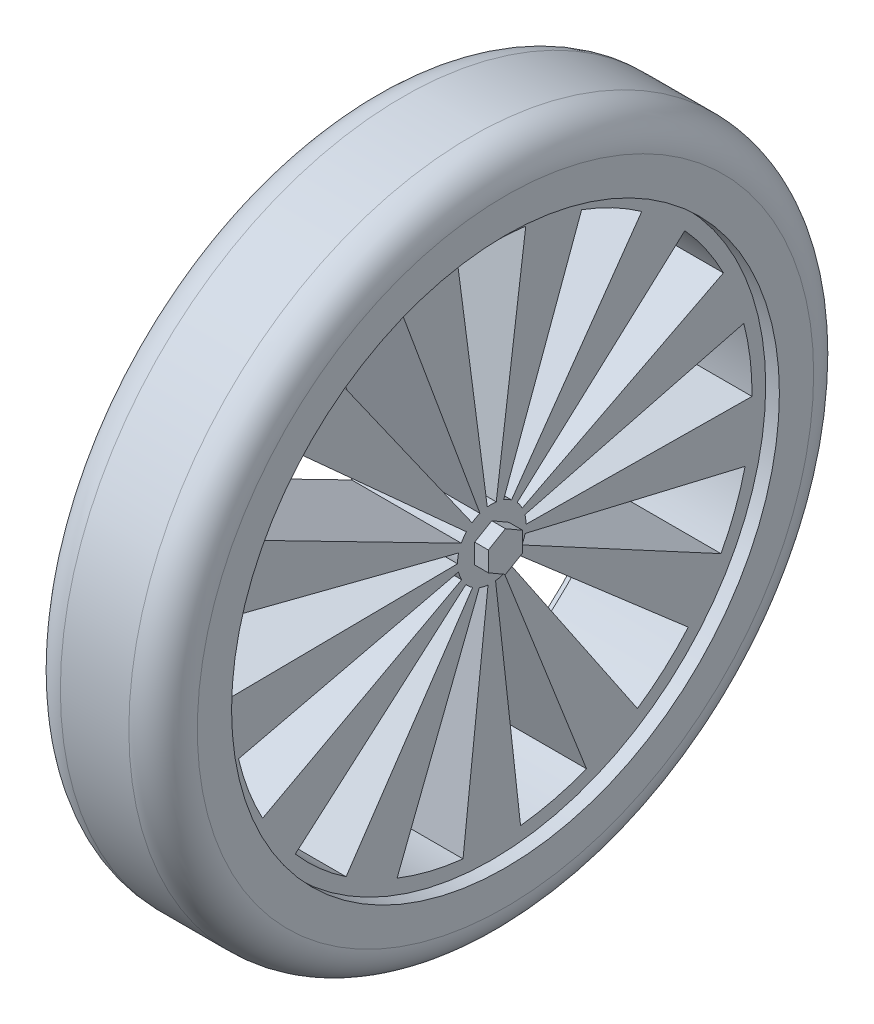
from build123d import *

# Parameters (mm, degrees)
SKETCH1_R           = 50
BOSS_EXTRUDE1_DEPTH = 20
SKETCH2_R           = 40
CUT_EXTRUDE1_DEPTH  = 2
CUT_EXTRUDE2_DEPTH  = 73.965745388
CIRPATTERN1_COUNT   = 13
FILLET1_R           = 5
BOSS_EXTRUDE2_DEPTH = 2


with BuildPart() as part:
    # Sketch1 → Boss-Extrude1 (new body)
    with BuildSketch(Plane(origin=(0, 0, 0), x_dir=(0, 0, -1), z_dir=(1, 0, 0))):
        Circle(SKETCH1_R)
    extrude(amount=BOSS_EXTRUDE1_DEPTH)

    # Sketch2 → Cut-Extrude1 (cut)
    with BuildSketch(Plane.ZY):
        Circle(SKETCH2_R)
    cut_extrude1 = extrude(amount=-CUT_EXTRUDE1_DEPTH, mode=Mode.SUBTRACT)

    # Mirror1: Cut-Extrude1 across plane
    add(cut_extrude1.mirror(Plane(origin=(10, 0, 0), x_dir=(0, 0, 1), z_dir=(1, 0, 0))), mode=Mode.SUBTRACT)

    # Sketch3 → Cut-Extrude2 (cut, through all)
    with BuildSketch(Plane.ZY.offset(-2)):
        with BuildLine():
            Line((0, 38), (0, 5))
            ThreePointArc((0, 5), (0.327015646, 4.989294616), (0.652630961, 4.957224307))
            Line((0.652630961, 4.957224307), (4.959995304, 37.674904732))
            ThreePointArc((4.959995304, 37.674904732), (2.485318911, 37.918639083), (0, 38))
        make_face()
        with BuildLine():
            ThreePointArc((-0.652630961, 4.957224307), (-0.327015646, 4.989294616), (0, 5))
            Line((0, 5), (0, 38))
            ThreePointArc((0, 38), (-2.485318911, 37.918639083), (-4.959995304, 37.674904732))
            Line((-4.959995304, 37.674904732), (-0.652630961, 4.957224307))
        make_face()
    cut_extrude2 = extrude(amount=-CUT_EXTRUDE2_DEPTH, mode=Mode.SUBTRACT)

    # CirPattern1: Cut-Extrude2 ×13 about axis
    cirpattern1_axis = Axis((0, 0, 0), (1, 0, 0))
    for i in range(1, CIRPATTERN1_COUNT):
        add(cut_extrude2.rotate(cirpattern1_axis, i * 360 / CIRPATTERN1_COUNT), mode=Mode.SUBTRACT)

    # Fillet1
    fillet1_edges = [part.edges().sort_by_distance(p)[0] for p in [
        (0, 0, 50),
        (20, 0, 50),
    ]]
    fillet(fillet1_edges, radius=FILLET1_R)

    # Sketch4 → Boss-Extrude2 (add)
    with BuildSketch(Plane.ZY.offset(-2)):
        Polygon((0, -2.886751346), (2.5, -1.443375673), (2.5, 1.443375673), (0, 2.886751346), (-2.5, 1.443375673), (-2.5, -1.443375673), align=None)
    boss_extrude2 = extrude(amount=BOSS_EXTRUDE2_DEPTH)

    # Mirror2: Boss-Extrude2 across plane
    add(boss_extrude2.mirror(Plane(origin=(10, 0, 0), x_dir=(0, 0, 1), z_dir=(1, 0, 0))))


solid = part.part
